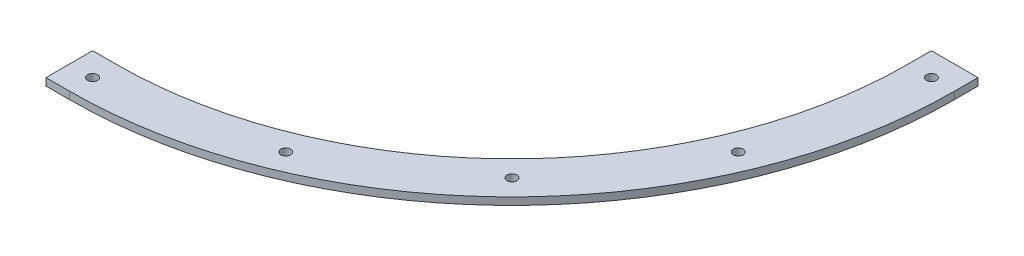
from build123d import *

# Parameters (mm, degrees)
SKETCH1_R           = 2.125
BOSS_EXTRUDE1_DEPTH = 3.175
CUT_EXTRUDE1_DEPTH  = 396.992525971
BOSS_EXTRUDE2_DEPTH = 3.175
SKETCH4_R           = 2.125
CUT_EXTRUDE2_DEPTH  = 396.992525971


with BuildPart() as part:
    # Sketch1 → Boss-Extrude1 (new body)
    with BuildSketch(Plane(origin=(0, 0, 0), x_dir=(1, 0, 0), z_dir=(0, 1, 0))):
        Polygon((0, -280), (100, -280), (100, -209.601551084), (209.601551084, -100), (280, -100), (280, 0), (280, 100), (209.601551084, 100), (100, 209.601551084), (100, 280), (0, 280), (-100, 280), (-100, 209.601551084), (-209.601551084, 100), (-280, 100), (-280, 0), (-280, -100), (-209.601551084, -100), (-100, -209.601551084), (-100, -280), align=None)
        with Locations(Location((-47.5, -192, 0), (0, 0, 270))):
            Circle(SKETCH1_R, mode=Mode.SUBTRACT)
        with Locations(Location((-47.5, -217, 0), (0, 0, 270))):
            Circle(SKETCH1_R, mode=Mode.SUBTRACT)
        with Locations(Location((47.5, -217, 0), (0, 0, 270))):
            Circle(SKETCH1_R, mode=Mode.SUBTRACT)
        with Locations(Location((47.5, -192, 0), (0, 0, 270))):
            Circle(SKETCH1_R, mode=Mode.SUBTRACT)
        with Locations(Location((-192, 47.5, 0), (0, 0, 270))):
            Circle(SKETCH1_R, mode=Mode.SUBTRACT)
        with Locations(Location((-217, 47.5, 0), (0, 0, 270))):
            Circle(SKETCH1_R, mode=Mode.SUBTRACT)
        with Locations(Location((-192, -47.5, 0), (0, 0, 270))):
            Circle(SKETCH1_R, mode=Mode.SUBTRACT)
        with Locations(Location((-217, -47.5, 0), (0, 0, 270))):
            Circle(SKETCH1_R, mode=Mode.SUBTRACT)
        with Locations(Location((47.5, 192, 0), (0, 0, 270))):
            Circle(SKETCH1_R, mode=Mode.SUBTRACT)
        with Locations(Location((47.5, 217, 0), (0, 0, 270))):
            Circle(SKETCH1_R, mode=Mode.SUBTRACT)
        with Locations(Location((-47.5, 192, 0), (0, 0, 270))):
            Circle(SKETCH1_R, mode=Mode.SUBTRACT)
        with Locations(Location((-47.5, 217, 0), (0, 0, 270))):
            Circle(SKETCH1_R, mode=Mode.SUBTRACT)
        with Locations(Location((192, -47.5, 0), (0, 0, 270))):
            Circle(SKETCH1_R, mode=Mode.SUBTRACT)
        with Locations(Location((217, -47.5, 0), (0, 0, 270))):
            Circle(SKETCH1_R, mode=Mode.SUBTRACT)
        with Locations(Location((192, 47.5, 0), (0, 0, 270))):
            Circle(SKETCH1_R, mode=Mode.SUBTRACT)
        with Locations(Location((217, 47.5, 0), (0, 0, 270))):
            Circle(SKETCH1_R, mode=Mode.SUBTRACT)
        with Locations(Location((-90, -270, 0), (0, 0, 270))):
            Circle(SKETCH1_R, mode=Mode.SUBTRACT)
        with Locations(Location((-30, -270, 0), (0, 0, 270))):
            Circle(SKETCH1_R, mode=Mode.SUBTRACT)
        with Locations(Location((30, -270, 0), (0, 0, 270))):
            Circle(SKETCH1_R, mode=Mode.SUBTRACT)
        with Locations(Location((90, -270, 0), (0, 0, 270))):
            Circle(SKETCH1_R, mode=Mode.SUBTRACT)
        with Locations(Location((-270, 90, 0), (0, 0, 270))):
            Circle(SKETCH1_R, mode=Mode.SUBTRACT)
        with Locations(Location((-270, 30, 0), (0, 0, 270))):
            Circle(SKETCH1_R, mode=Mode.SUBTRACT)
        with Locations(Location((-270, -30, 0), (0, 0, 270))):
            Circle(SKETCH1_R, mode=Mode.SUBTRACT)
        with Locations(Location((-270, -90, 0), (0, 0, 270))):
            Circle(SKETCH1_R, mode=Mode.SUBTRACT)
        with Locations(Location((90, 270, 0), (0, 0, 270))):
            Circle(SKETCH1_R, mode=Mode.SUBTRACT)
        with Locations(Location((30, 270, 0), (0, 0, 270))):
            Circle(SKETCH1_R, mode=Mode.SUBTRACT)
        with Locations(Location((-30, 270, 0), (0, 0, 270))):
            Circle(SKETCH1_R, mode=Mode.SUBTRACT)
        with Locations(Location((-90, 270, 0), (0, 0, 270))):
            Circle(SKETCH1_R, mode=Mode.SUBTRACT)
        with Locations(Location((270, -90, 0), (0, 0, 270))):
            Circle(SKETCH1_R, mode=Mode.SUBTRACT)
        with Locations(Location((270, -30, 0), (0, 0, 270))):
            Circle(SKETCH1_R, mode=Mode.SUBTRACT)
        with Locations(Location((270, 30, 0), (0, 0, 270))):
            Circle(SKETCH1_R, mode=Mode.SUBTRACT)
        with Locations(Location((270, 90, 0), (0, 0, 270))):
            Circle(SKETCH1_R, mode=Mode.SUBTRACT)
        with Locations(Location((-90, -250, 0), (0, 0, 270))):
            Circle(SKETCH1_R, mode=Mode.SUBTRACT)
        with Locations(Location((-90, -180, 0), (0, 0, 270))):
            Circle(SKETCH1_R, mode=Mode.SUBTRACT)
        with Locations(Location((-90, -110, 0), (0, 0, 270))):
            Circle(SKETCH1_R, mode=Mode.SUBTRACT)
        with Locations(Location((-90, -40, 0), (0, 0, 270))):
            Circle(SKETCH1_R, mode=Mode.SUBTRACT)
        with Locations(Location((-90, 30, 0), (0, 0, 270))):
            Circle(SKETCH1_R, mode=Mode.SUBTRACT)
        with Locations(Location((-90, 50, 0), (0, 0, 270))):
            Circle(SKETCH1_R, mode=Mode.SUBTRACT)
        with Locations(Location((-90, 150, 0), (0, 0, 270))):
            Circle(SKETCH1_R, mode=Mode.SUBTRACT)
        with Locations(Location((-90, 250, 0), (0, 0, 270))):
            Circle(SKETCH1_R, mode=Mode.SUBTRACT)
        with Locations(Location((90, -250, 0), (0, 0, 270))):
            Circle(SKETCH1_R, mode=Mode.SUBTRACT)
        with Locations(Location((90, -180, 0), (0, 0, 270))):
            Circle(SKETCH1_R, mode=Mode.SUBTRACT)
        with Locations(Location((90, -110, 0), (0, 0, 270))):
            Circle(SKETCH1_R, mode=Mode.SUBTRACT)
        with Locations(Location((90, -40, 0), (0, 0, 270))):
            Circle(SKETCH1_R, mode=Mode.SUBTRACT)
        with Locations(Location((90, 30, 0), (0, 0, 270))):
            Circle(SKETCH1_R, mode=Mode.SUBTRACT)
        with Locations(Location((90, 50, 0), (0, 0, 270))):
            Circle(SKETCH1_R, mode=Mode.SUBTRACT)
        with Locations(Location((90, 150, 0), (0, 0, 270))):
            Circle(SKETCH1_R, mode=Mode.SUBTRACT)
        with Locations(Location((90, 250, 0), (0, 0, 270))):
            Circle(SKETCH1_R, mode=Mode.SUBTRACT)
        with Locations(Location((-250, -90, 0), (0, 0, 270))):
            Circle(SKETCH1_R, mode=Mode.SUBTRACT)
        with Locations(Location((-180, -90, 0), (0, 0, 270))):
            Circle(SKETCH1_R, mode=Mode.SUBTRACT)
        with Locations(Location((-110, -90, 0), (0, 0, 270))):
            Circle(SKETCH1_R, mode=Mode.SUBTRACT)
        with Locations(Location((-110, 90, 0), (0, 0, 270))):
            Circle(SKETCH1_R, mode=Mode.SUBTRACT)
        with Locations(Location((-180, 90, 0), (0, 0, 270))):
            Circle(SKETCH1_R, mode=Mode.SUBTRACT)
        with Locations(Location((-250, 90, 0), (0, 0, 270))):
            Circle(SKETCH1_R, mode=Mode.SUBTRACT)
        with Locations(Location((110, -90, 0), (0, 0, 270))):
            Circle(SKETCH1_R, mode=Mode.SUBTRACT)
        with Locations(Location((180, -90, 0), (0, 0, 270))):
            Circle(SKETCH1_R, mode=Mode.SUBTRACT)
        with Locations(Location((250, -90, 0), (0, 0, 270))):
            Circle(SKETCH1_R, mode=Mode.SUBTRACT)
        with Locations(Location((110, 90, 0), (0, 0, 270))):
            Circle(SKETCH1_R, mode=Mode.SUBTRACT)
        with Locations(Location((180, 90, 0), (0, 0, 270))):
            Circle(SKETCH1_R, mode=Mode.SUBTRACT)
        with Locations(Location((250, 90, 0), (0, 0, 270))):
            Circle(SKETCH1_R, mode=Mode.SUBTRACT)
    extrude(amount=BOSS_EXTRUDE1_DEPTH)

    # Sketch2 → Cut-Extrude1 (cut, through all)
    with BuildSketch(Plane(origin=(0, 3.175, 0), x_dir=(1, 0, 0), z_dir=(0, 1, 0))):
        Polygon((80, -260), (100, -260), (100, -209.601551084), (209.601551084, -100), (260, -100), (260, -80), (280, -80), (280, 100), (209.601551084, 100), (100, 209.601551084), (100, 280), (-100, 280), (-100, 209.601551084), (-209.601551084, 100), (-280, 100), (-280, -100), (-209.601551084, -100), (-100, -209.601551084), (-100, -280), (80, -280), align=None)
    extrude(amount=-CUT_EXTRUDE1_DEPTH, mode=Mode.SUBTRACT)


with BuildPart() as cut_extrude1_piece_1:
    # of the separate pieces the step leaves, piece 1, a body of its own (cut_extrude1_pieces)
    add(part.part.solids().sort_by_distance((100, 0, 280))[0])



with BuildPart() as cut_extrude1_piece_2:
    # of the separate pieces the step leaves, piece 2, a body of its own (cut_extrude1_pieces)
    add(part.part.solids().sort_by_distance((260, 3.175, 100))[0])


with BuildPart() as cut_extrude1_piece_1_1:
    add(cut_extrude1_piece_1.part)

    add(cut_extrude1_piece_2.part)  # Boss-Extrude2 merges Cut-Extrude1 piece 2
    # Sketch3 → Boss-Extrude2 (add)
    with BuildSketch(Plane(origin=(0, 3.175, 0), x_dir=(1, 0, 0), z_dir=(0, 1, 0))):
        with BuildLine():
            Line((260, -90), (267.875, -90))
            ThreePointArc((267.875, -90), (270, -92.125), (272.125, -90))
            Line((272.125, -90), (280, -90))
            ThreePointArc((280, -90), (224.350288425, -224.350288425), (90, -280))
            Line((90, -280), (90, -272.125))
            ThreePointArc((90, -272.125), (92.125, -270), (90, -267.875))
            Line((90, -267.875), (90, -260))
            ThreePointArc((90, -260), (210.208152802, -210.208152802), (260, -90))
        make_face()
    extrude(amount=-BOSS_EXTRUDE2_DEPTH)

    # Sketch4 → Cut-Extrude2 (cut, through all)
    with BuildSketch(Plane(origin=(0, 3.175, 0), x_dir=(1, 0, 0), z_dir=(0, 1, 0))):
        with Locations(Location((217.279220614, -217.279220614, 0), (0, 0, 270))):
            Circle(SKETCH4_R)
        with Locations(Location((256.207454383, -159.101968912, 0), (0, 0, 270))):
            Circle(SKETCH4_R)
        with Locations(Location((159.101968912, -256.207454383, 0), (0, 0, 90))):
            Circle(SKETCH4_R)
        with BuildLine():
            Line((100, -280), (90, -280))
            ThreePointArc((90, -280), (95.001733404, -279.934153493), (100, -279.73665961))
            Line((100, -279.73665961), (100, -280))
        make_face()
        with BuildLine():
            Line((279.73665961, -100), (284.415704741, -100))
            Line((284.415704741, -100), (280, -90))
            ThreePointArc((280, -90), (279.934153493, -95.001733404), (279.73665961, -100))
        make_face()
    extrude(amount=-CUT_EXTRUDE2_DEPTH, mode=Mode.SUBTRACT)


solid = cut_extrude1_piece_1_1.part
